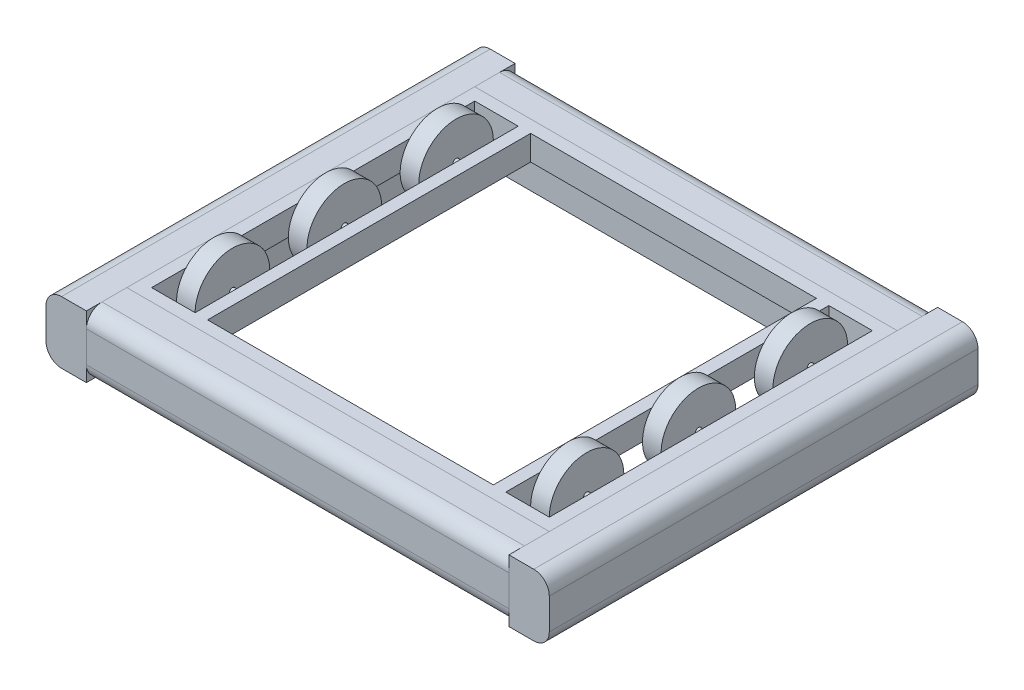
from build123d import *

# Parameters (mm, degrees)
SKETCH1_W                       = 863.6
SKETCH1_H                       = 711.2
SKETCH1_W_2                     = 812.8
SKETCH1_H_2                     = 660.4
SKETCH1_W_3                     = 25.4
BOSS_EXTRUDE1_DEPTH             = 50.8
BOSS_EXTRUDE2_DEPTH             = 19.05
BOSS_EXTRUDE2_DEPTH_BACK        = 19.05
SKETCH3_R                       = 76.2
BOSS_EXTRUDE2_2_DEPTH           = 19.05
BOSS_EXTRUDE2_2_DEPTH_BACK      = 19.05
BOSS_EXTRUDE2_3_DEPTH           = 19.05
BOSS_EXTRUDE2_3_DEPTH_BACK      = 19.05
BOSS_EXTRUDE3_REACH             = 1072.592
SKETCH4_R                       = 6.35
BOSS_EXTRUDE3_DIRECTION_2_REACH = 1072.592
BOSS_EXTRUDE4_DEPTH             = 19.05
BOSS_EXTRUDE4_DEPTH_BACK        = 19.05
SKETCH5_R                       = 76.2
BOSS_EXTRUDE4_2_DEPTH           = 19.05
BOSS_EXTRUDE4_2_DEPTH_BACK      = 19.05
BOSS_EXTRUDE4_3_DEPTH           = 19.05
BOSS_EXTRUDE4_3_DEPTH_BACK      = 19.05
BOSS_EXTRUDE5_REACH             = 1072.592
SKETCH6_R                       = 6.35
BOSS_EXTRUDE5_DIRECTION_2_REACH = 1072.592
BOSS_EXTRUDE6_DEPTH             = 82.55
BOSS_EXTRUDE6_DEPTH_BACK        = 793.75
SKETCH7_R                       = 31.75
SKETCH8_R                       = 31.75
BOSS_EXTRUDE7_DEPTH             = 863.6


with BuildPart() as part:
    # Sketch1 → Boss-Extrude1 (new body)
    # profile 1 of 3: a face of its own
    with BuildSketch(Plane(origin=(0, 0, 0), x_dir=(1, 0, 0), z_dir=(0, 1, 0))):
        with Locations((431.8, 355.6)):
            Rectangle(SKETCH1_W, SKETCH1_H)
        with Locations((431.8, 355.6)):
            Rectangle(SKETCH1_W_2, SKETCH1_H_2, mode=Mode.SUBTRACT)
    # profile 2 of 3: a face of its own
    with BuildSketch(Plane(origin=(0, 0, 0), x_dir=(1, 0, 0), z_dir=(0, 1, 0))):
        with Locations((127, 355.6)):
            Rectangle(SKETCH1_W_3, SKETCH1_H_2)
    # profile 3 of 3: a face of its own
    with BuildSketch(Plane(origin=(0, 0, 0), x_dir=(1, 0, 0), z_dir=(0, 1, 0))):
        with Locations((736.6, 355.6)):
            Rectangle(SKETCH1_W_3, SKETCH1_H_2)
    extrude(amount=BOSS_EXTRUDE1_DEPTH)

    # Boss-Extrude3: up to this face of the body (flat: up to its plane)
    boss_extrude3_end = Plane(part.part.faces().sort_by_distance((838.2, 25.4, -355.6))[0])
    # Sketch4 → Boss-Extrude3 (add, up to the picked face)
    with BuildSketch(Plane(origin=(793.75, 0, 0), x_dir=(0, 0, -1), z_dir=(1, 0, 0)), mode=Mode.PRIVATE) as boss_extrude3_sk1:
        with Locations((584.2, 25.4)):
            Circle(SKETCH4_R)
    boss_extrude3_tool1 = split(extrude(boss_extrude3_sk1.sketch, amount=BOSS_EXTRUDE3_REACH, mode=Mode.PRIVATE), bisect_by=boss_extrude3_end, keep=Keep.BOTH, mode=Mode.PRIVATE)
    # Sketch4 → Boss-Extrude3 (add, up to the picked face)
    with BuildSketch(Plane(origin=(793.75, 0, 0), x_dir=(0, 0, -1), z_dir=(1, 0, 0)), mode=Mode.PRIVATE) as boss_extrude3_sk2:
        with Locations((355.6, 25.4)):
            Circle(SKETCH4_R)
    boss_extrude3_tool2 = split(extrude(boss_extrude3_sk2.sketch, amount=BOSS_EXTRUDE3_REACH, mode=Mode.PRIVATE), bisect_by=boss_extrude3_end, keep=Keep.BOTH, mode=Mode.PRIVATE)
    # Sketch4 → Boss-Extrude3 (add, up to the picked face)
    with BuildSketch(Plane(origin=(793.75, 0, 0), x_dir=(0, 0, -1), z_dir=(1, 0, 0)), mode=Mode.PRIVATE) as boss_extrude3_sk3:
        with Locations((127, 25.4)):
            Circle(SKETCH4_R)
    boss_extrude3_tool3 = split(extrude(boss_extrude3_sk3.sketch, amount=BOSS_EXTRUDE3_REACH, mode=Mode.PRIVATE), bisect_by=boss_extrude3_end, keep=Keep.BOTH, mode=Mode.PRIVATE)


with BuildPart() as body_2:
    # Sketch3 → Boss-Extrude2 (new, two sides: drawn at the far end of the back side and taken through both)
    with BuildSketch(Plane(origin=(793.75, 0, 0), x_dir=(0, 0, -1), z_dir=(1, 0, 0)).offset(-BOSS_EXTRUDE2_DEPTH_BACK)):
        with Locations((127, 25.4)):
            Circle(SKETCH3_R)
    extrude(amount=BOSS_EXTRUDE2_DEPTH + BOSS_EXTRUDE2_DEPTH_BACK)


with BuildPart() as body_3:
    # Sketch3 → Boss-Extrude2 2 (new, two sides: drawn at the far end of the back side and taken through both)
    with BuildSketch(Plane(origin=(793.75, 0, 0), x_dir=(0, 0, -1), z_dir=(1, 0, 0)).offset(-BOSS_EXTRUDE2_2_DEPTH_BACK)):
        with Locations((355.6, 25.4)):
            Circle(SKETCH3_R)
    extrude(amount=BOSS_EXTRUDE2_2_DEPTH + BOSS_EXTRUDE2_2_DEPTH_BACK)


with BuildPart() as body_4:
    # Sketch3 → Boss-Extrude2 3 (new, two sides: drawn at the far end of the back side and taken through both)
    with BuildSketch(Plane(origin=(793.75, 0, 0), x_dir=(0, 0, -1), z_dir=(1, 0, 0)).offset(-BOSS_EXTRUDE2_3_DEPTH_BACK)):
        with Locations((584.2, 25.4)):
            Circle(SKETCH3_R)
    extrude(amount=BOSS_EXTRUDE2_3_DEPTH + BOSS_EXTRUDE2_3_DEPTH_BACK)


with BuildPart() as part_1:
    add(part.part)

    add(body_2.part)  # Boss-Extrude3 merges body 2

    add(body_3.part)  # Boss-Extrude3 merges body 3

    add(body_4.part)  # Boss-Extrude3 merges body 4
    add(boss_extrude3_tool1.solids().sort_by(Axis((793.75, 25.4, -584.2), (1, 0, 0)))[0])
    add(boss_extrude3_tool2.solids().sort_by(Axis((793.75, 25.4, -355.6), (1, 0, 0)))[0])
    add(boss_extrude3_tool3.solids().sort_by(Axis((793.75, 25.4, -127), (1, 0, 0)))[0])

    # Boss-Extrude3 direction 2: up to this face of the body (flat: up to its plane)
    boss_extrude3_direction_2_end = Plane(part_1.part.faces().sort_by_distance((749.3, 25.4, -355.6))[0])
    # Sketch4 → Boss-Extrude3 direction 2 (add, up to the picked face)
    with BuildSketch(Plane(origin=(793.75, 0, 0), x_dir=(0, 0, -1), z_dir=(1, 0, 0)), mode=Mode.PRIVATE) as boss_extrude3_direction_2_sk1:
        with Locations((584.2, 25.4)):
            Circle(SKETCH4_R)
    boss_extrude3_direction_2_tool1 = split(extrude(boss_extrude3_direction_2_sk1.sketch, amount=-BOSS_EXTRUDE3_DIRECTION_2_REACH, mode=Mode.PRIVATE), bisect_by=boss_extrude3_direction_2_end, keep=Keep.BOTH, mode=Mode.PRIVATE)
    # Sketch4 → Boss-Extrude3 direction 2 (add, up to the picked face)
    with BuildSketch(Plane(origin=(793.75, 0, 0), x_dir=(0, 0, -1), z_dir=(1, 0, 0)), mode=Mode.PRIVATE) as boss_extrude3_direction_2_sk2:
        with Locations((355.6, 25.4)):
            Circle(SKETCH4_R)
    boss_extrude3_direction_2_tool2 = split(extrude(boss_extrude3_direction_2_sk2.sketch, amount=-BOSS_EXTRUDE3_DIRECTION_2_REACH, mode=Mode.PRIVATE), bisect_by=boss_extrude3_direction_2_end, keep=Keep.BOTH, mode=Mode.PRIVATE)
    # Sketch4 → Boss-Extrude3 direction 2 (add, up to the picked face)
    with BuildSketch(Plane(origin=(793.75, 0, 0), x_dir=(0, 0, -1), z_dir=(1, 0, 0)), mode=Mode.PRIVATE) as boss_extrude3_direction_2_sk3:
        with Locations((127, 25.4)):
            Circle(SKETCH4_R)
    boss_extrude3_direction_2_tool3 = split(extrude(boss_extrude3_direction_2_sk3.sketch, amount=-BOSS_EXTRUDE3_DIRECTION_2_REACH, mode=Mode.PRIVATE), bisect_by=boss_extrude3_direction_2_end, keep=Keep.BOTH, mode=Mode.PRIVATE)
    add(boss_extrude3_direction_2_tool1.solids().sort_by(Axis((793.75, 25.4, -584.2), (-1, 0, 0)))[0])
    add(boss_extrude3_direction_2_tool2.solids().sort_by(Axis((793.75, 25.4, -355.6), (-1, 0, 0)))[0])
    add(boss_extrude3_direction_2_tool3.solids().sort_by(Axis((793.75, 25.4, -127), (-1, 0, 0)))[0])

    # Boss-Extrude5: up to this face of the body (flat: up to its plane)
    boss_extrude5_end = Plane(part_1.part.faces().sort_by_distance((114.3, 25.4, -355.6))[0])
    # Sketch6 → Boss-Extrude5 (add, up to the picked face)
    with BuildSketch(Plane(origin=(69.85, 0, 0), x_dir=(0, 0, -1), z_dir=(1, 0, 0)), mode=Mode.PRIVATE) as boss_extrude5_sk1:
        with Locations(Location((127, 25.4, 0), (0, 0, 180))):
            Circle(SKETCH6_R)
    boss_extrude5_tool1 = split(extrude(boss_extrude5_sk1.sketch, amount=BOSS_EXTRUDE5_REACH, mode=Mode.PRIVATE), bisect_by=boss_extrude5_end, keep=Keep.BOTH, mode=Mode.PRIVATE)
    # Sketch6 → Boss-Extrude5 (add, up to the picked face)
    with BuildSketch(Plane(origin=(69.85, 0, 0), x_dir=(0, 0, -1), z_dir=(1, 0, 0)), mode=Mode.PRIVATE) as boss_extrude5_sk2:
        with Locations(Location((355.6, 25.4, 0), (0, 0, 180))):
            Circle(SKETCH6_R)
    boss_extrude5_tool2 = split(extrude(boss_extrude5_sk2.sketch, amount=BOSS_EXTRUDE5_REACH, mode=Mode.PRIVATE), bisect_by=boss_extrude5_end, keep=Keep.BOTH, mode=Mode.PRIVATE)
    # Sketch6 → Boss-Extrude5 (add, up to the picked face)
    with BuildSketch(Plane(origin=(69.85, 0, 0), x_dir=(0, 0, -1), z_dir=(1, 0, 0)), mode=Mode.PRIVATE) as boss_extrude5_sk3:
        with Locations(Location((584.2, 25.4, 0), (0, 0, 180))):
            Circle(SKETCH6_R)
    boss_extrude5_tool3 = split(extrude(boss_extrude5_sk3.sketch, amount=BOSS_EXTRUDE5_REACH, mode=Mode.PRIVATE), bisect_by=boss_extrude5_end, keep=Keep.BOTH, mode=Mode.PRIVATE)


with BuildPart() as body_2_2:
    # Sketch5 → Boss-Extrude4 (new, two sides: drawn at the far end of the back side and taken through both)
    with BuildSketch(Plane(origin=(69.85, 0, 0), x_dir=(0, 0, -1), z_dir=(1, 0, 0)).offset(-BOSS_EXTRUDE4_DEPTH_BACK)):
        with Locations((584.2, 25.4)):
            Circle(SKETCH5_R)
    extrude(amount=BOSS_EXTRUDE4_DEPTH + BOSS_EXTRUDE4_DEPTH_BACK)


with BuildPart() as body_3_2:
    # Sketch5 → Boss-Extrude4 2 (new, two sides: drawn at the far end of the back side and taken through both)
    with BuildSketch(Plane(origin=(69.85, 0, 0), x_dir=(0, 0, -1), z_dir=(1, 0, 0)).offset(-BOSS_EXTRUDE4_2_DEPTH_BACK)):
        with Locations((355.6, 25.4)):
            Circle(SKETCH5_R)
    extrude(amount=BOSS_EXTRUDE4_2_DEPTH + BOSS_EXTRUDE4_2_DEPTH_BACK)


with BuildPart() as body_4_2:
    # Sketch5 → Boss-Extrude4 3 (new, two sides: drawn at the far end of the back side and taken through both)
    with BuildSketch(Plane(origin=(69.85, 0, 0), x_dir=(0, 0, -1), z_dir=(1, 0, 0)).offset(-BOSS_EXTRUDE4_3_DEPTH_BACK)):
        with Locations((127, 25.4)):
            Circle(SKETCH5_R)
    extrude(amount=BOSS_EXTRUDE4_3_DEPTH + BOSS_EXTRUDE4_3_DEPTH_BACK)


with BuildPart() as part_2:
    add(part_1.part)

    add(body_2_2.part)  # Boss-Extrude5 merges body 2 2

    add(body_3_2.part)  # Boss-Extrude5 merges body 3 2

    add(body_4_2.part)  # Boss-Extrude5 merges body 4 2
    add(boss_extrude5_tool1.solids().sort_by(Axis((69.85, 25.4, -127), (1, 0, 0)))[0])
    add(boss_extrude5_tool2.solids().sort_by(Axis((69.85, 25.4, -355.6), (1, 0, 0)))[0])
    add(boss_extrude5_tool3.solids().sort_by(Axis((69.85, 25.4, -584.2), (1, 0, 0)))[0])

    # Boss-Extrude5 direction 2: up to this face of the body (flat: up to its plane)
    boss_extrude5_direction_2_end = Plane(part_2.part.faces().sort_by_distance((25.4, 25.4, -355.6))[0])
    # Sketch6 → Boss-Extrude5 direction 2 (add, up to the picked face)
    with BuildSketch(Plane(origin=(69.85, 0, 0), x_dir=(0, 0, -1), z_dir=(1, 0, 0)), mode=Mode.PRIVATE) as boss_extrude5_direction_2_sk1:
        with Locations(Location((127, 25.4, 0), (0, 0, 180))):
            Circle(SKETCH6_R)
    boss_extrude5_direction_2_tool1 = split(extrude(boss_extrude5_direction_2_sk1.sketch, amount=-BOSS_EXTRUDE5_DIRECTION_2_REACH, mode=Mode.PRIVATE), bisect_by=boss_extrude5_direction_2_end, keep=Keep.BOTH, mode=Mode.PRIVATE)
    # Sketch6 → Boss-Extrude5 direction 2 (add, up to the picked face)
    with BuildSketch(Plane(origin=(69.85, 0, 0), x_dir=(0, 0, -1), z_dir=(1, 0, 0)), mode=Mode.PRIVATE) as boss_extrude5_direction_2_sk2:
        with Locations(Location((355.6, 25.4, 0), (0, 0, 180))):
            Circle(SKETCH6_R)
    boss_extrude5_direction_2_tool2 = split(extrude(boss_extrude5_direction_2_sk2.sketch, amount=-BOSS_EXTRUDE5_DIRECTION_2_REACH, mode=Mode.PRIVATE), bisect_by=boss_extrude5_direction_2_end, keep=Keep.BOTH, mode=Mode.PRIVATE)
    # Sketch6 → Boss-Extrude5 direction 2 (add, up to the picked face)
    with BuildSketch(Plane(origin=(69.85, 0, 0), x_dir=(0, 0, -1), z_dir=(1, 0, 0)), mode=Mode.PRIVATE) as boss_extrude5_direction_2_sk3:
        with Locations(Location((584.2, 25.4, 0), (0, 0, 180))):
            Circle(SKETCH6_R)
    boss_extrude5_direction_2_tool3 = split(extrude(boss_extrude5_direction_2_sk3.sketch, amount=-BOSS_EXTRUDE5_DIRECTION_2_REACH, mode=Mode.PRIVATE), bisect_by=boss_extrude5_direction_2_end, keep=Keep.BOTH, mode=Mode.PRIVATE)
    add(boss_extrude5_direction_2_tool1.solids().sort_by(Axis((69.85, 25.4, -127), (-1, 0, 0)))[0])
    add(boss_extrude5_direction_2_tool2.solids().sort_by(Axis((69.85, 25.4, -355.6), (-1, 0, 0)))[0])
    add(boss_extrude5_direction_2_tool3.solids().sort_by(Axis((69.85, 25.4, -584.2), (-1, 0, 0)))[0])


with BuildPart() as body_2_3:
    # Sketch7 → Boss-Extrude6 (new, two sides: drawn at the far end of the back side and taken through both)
    with BuildSketch(Plane(origin=(0, 0, -711.2), x_dir=(-1, 0, 0), z_dir=(0, 0, -1)).offset(-BOSS_EXTRUDE6_DEPTH_BACK)):
        Polygon((-882.65, -44.45), (-882.65, -76.2), (-863.6, -76.2), (-863.6, 0), (-863.6, 50.8), (-882.65, 50.8), (-882.65, 19.05), align=None)
        with BuildLine():
            Line((-914.4, -76.2), (-882.65, -76.2))
            Line((-882.65, -76.2), (-882.65, -44.45))
            ThreePointArc((-882.65, -44.45), (-891.949359697, -66.900640303), (-914.4, -76.2))
        make_face()
        with Locations((-914.4, -44.45)):
            Circle(SKETCH7_R)
        with BuildLine():
            ThreePointArc((-914.4, -12.7), (-891.949359697, -21.999359697), (-882.65, -44.45))
            Line((-882.65, -44.45), (-882.65, 19.05))
            ThreePointArc((-882.65, 19.05), (-891.949359697, -3.400640303), (-914.4, -12.7))
        make_face()
        with BuildLine():
            ThreePointArc((-914.4, 50.8), (-891.949359697, 41.500640303), (-882.65, 19.05))
            Line((-882.65, 19.05), (-882.65, 50.8))
            Line((-882.65, 50.8), (-914.4, 50.8))
        make_face()
        with Locations((-914.4, 19.05)):
            Circle(SKETCH7_R)
        with BuildLine():
            Line((-946.15, 19.05), (-946.15, -44.45))
            ThreePointArc((-946.15, -44.45), (-936.850640303, -21.999359697), (-914.4, -12.7))
            ThreePointArc((-914.4, -12.7), (-936.850640303, -3.400640303), (-946.15, 19.05))
        make_face()
        with Locations((50.8, 19.05)):
            Circle(SKETCH7_R)
        with BuildLine():
            ThreePointArc((50.8, -12.7), (73.250640303, -21.999359697), (82.55, -44.45))
            Line((82.55, -44.45), (82.55, 19.05))
            ThreePointArc((82.55, 19.05), (73.250640303, -3.400640303), (50.8, -12.7))
        make_face()
        with Locations((50.8, -44.45)):
            Circle(SKETCH7_R)
        Polygon((0, -76.2), (19.05, -76.2), (19.05, -44.45), (19.05, 19.05), (19.05, 50.8), (0, 50.8), (0, 0), align=None)
        with BuildLine():
            ThreePointArc((19.05, -44.45), (28.349359697, -21.999359697), (50.8, -12.7))
            ThreePointArc((50.8, -12.7), (28.349359697, -3.400640303), (19.05, 19.05))
            Line((19.05, 19.05), (19.05, -44.45))
        make_face()
        with BuildLine():
            ThreePointArc((19.05, 19.05), (28.349359697, 41.500640303), (50.8, 50.8))
            Line((50.8, 50.8), (19.05, 50.8))
            Line((19.05, 50.8), (19.05, 19.05))
        make_face()
        with BuildLine():
            Line((19.05, -76.2), (50.8, -76.2))
            ThreePointArc((50.8, -76.2), (28.349359697, -66.900640303), (19.05, -44.45))
            Line((19.05, -44.45), (19.05, -76.2))
        make_face()
    extrude(amount=BOSS_EXTRUDE6_DEPTH + BOSS_EXTRUDE6_DEPTH_BACK)


with BuildPart() as body_3_3:
    # Sketch8 → Boss-Extrude7 (new body)
    with BuildSketch(Plane.ZY.offset(-863.6)):
        with Locations((50.8, -44.45)):
            Circle(SKETCH8_R)
        Polygon((19.05, 50.8), (0, 50.8), (0, -76.2), (19.05, -76.2), (19.05, -44.45), (19.05, 19.05), align=None)
        with BuildLine():
            Line((19.05, -44.45), (19.05, -76.2))
            Line((19.05, -76.2), (50.8, -76.2))
            ThreePointArc((50.8, -76.2), (28.349359697, -66.900640303), (19.05, -44.45))
        make_face()
        with BuildLine():
            ThreePointArc((50.8, -12.7), (28.349359697, -3.400640303), (19.05, 19.05))
            Line((19.05, 19.05), (19.05, -44.45))
            ThreePointArc((19.05, -44.45), (28.349359697, -21.999359697), (50.8, -12.7))
        make_face()
        with BuildLine():
            Line((50.8, 50.8), (19.05, 50.8))
            Line((19.05, 50.8), (19.05, 19.05))
            ThreePointArc((19.05, 19.05), (28.349359697, 41.500640303), (50.8, 50.8))
        make_face()
        with BuildLine():
            Line((82.55, -44.45), (82.55, 19.05))
            ThreePointArc((82.55, 19.05), (73.250640303, -3.400640303), (50.8, -12.7))
            ThreePointArc((50.8, -12.7), (73.250640303, -21.999359697), (82.55, -44.45))
        make_face()
        with Locations((50.8, 19.05)):
            Circle(SKETCH8_R)
        Polygon((-711.2, -76.2), (-711.2, 50.8), (-730.25, 50.8), (-730.25, 19.05), (-730.25, -44.45), (-730.25, -76.2), align=None)
        with BuildLine():
            Line((-762, -76.2), (-730.25, -76.2))
            Line((-730.25, -76.2), (-730.25, -44.45))
            ThreePointArc((-730.25, -44.45), (-739.549359697, -66.900640303), (-762, -76.2))
        make_face()
        with Locations((-762, -44.45)):
            Circle(SKETCH8_R)
        with BuildLine():
            Line((-730.25, -44.45), (-730.25, 19.05))
            ThreePointArc((-730.25, 19.05), (-739.549359697, -3.400640303), (-762, -12.7))
            ThreePointArc((-762, -12.7), (-739.549359697, -21.999359697), (-730.25, -44.45))
        make_face()
        with Locations((-762, 19.05)):
            Circle(SKETCH8_R)
        with BuildLine():
            ThreePointArc((-793.75, -44.45), (-784.450640303, -21.999359697), (-762, -12.7))
            ThreePointArc((-762, -12.7), (-784.450640303, -3.400640303), (-793.75, 19.05))
            Line((-793.75, 19.05), (-793.75, -44.45))
        make_face()
        with BuildLine():
            Line((-730.25, 19.05), (-730.25, 50.8))
            Line((-730.25, 50.8), (-762, 50.8))
            ThreePointArc((-762, 50.8), (-739.549359697, 41.500640303), (-730.25, 19.05))
        make_face()
    extrude(amount=BOSS_EXTRUDE7_DEPTH)


solid = Compound([part_2.part, body_2_3.part, body_3_3.part])
